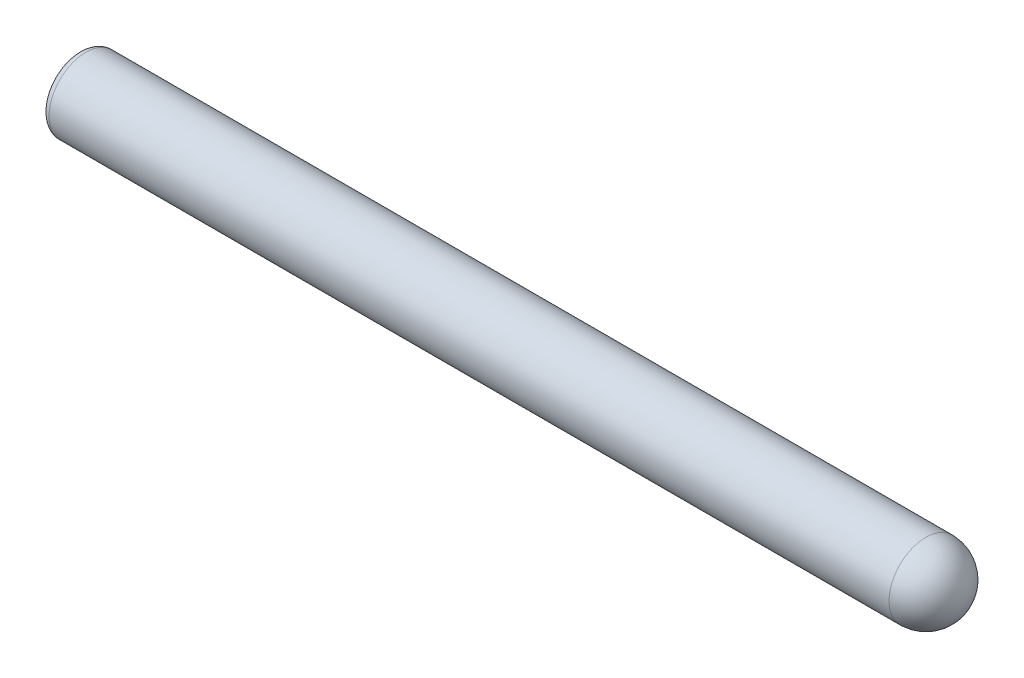
from build123d import *

# Parameters (mm, degrees)
ESBO_O1_R                = 0.5
RESSALTO_EXTRUS_O1_DEPTH = 12
FILETE5_R                = 0.5
FILETE6_R                = 0.1


with BuildPart() as part:
    # Esboço1 → Ressalto-extrusão1 (new body)
    with BuildSketch(Plane(origin=(0, 0, 0), x_dir=(0, 0, -1), z_dir=(1, 0, 0))):
        Circle(ESBO_O1_R)
    extrude(amount=RESSALTO_EXTRUS_O1_DEPTH)

    # Filete5
    filete5_edges = [part.edges().sort_by_distance(p)[0] for p in [
        (12, 0, 0.5),
    ]]
    fillet(filete5_edges, radius=FILETE5_R)

    # Filete6
    filete6_edges = [part.edges().sort_by_distance(p)[0] for p in [
        (0, 0, 0.5),
    ]]
    fillet(filete6_edges, radius=FILETE6_R)


solid = part.part
